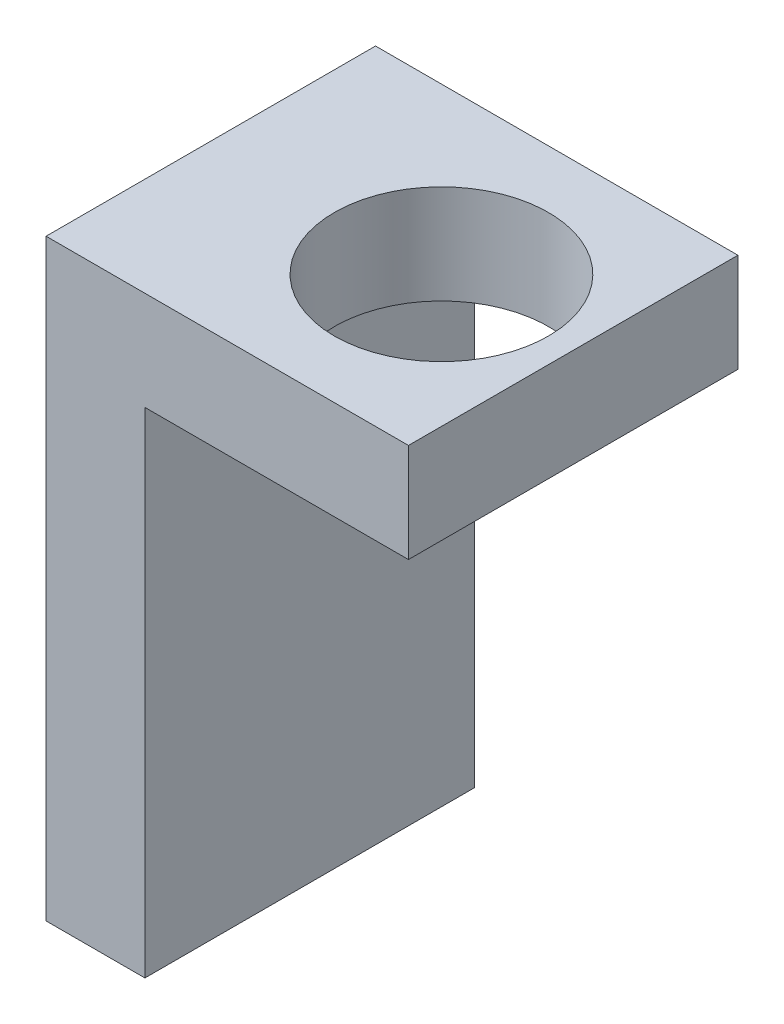
from build123d import *

# Parameters (mm, degrees)
SKETCH1_W           = 8
SKETCH1_H           = 10
SKETCH1_R           = 1.5
BOSS_EXTRUDE1_DEPTH = 3
SKETCH2_W           = 3
SKETCH2_H           = 10
BOSS_EXTRUDE2_DEPTH = 18
SKETCH3_R           = 3.25
CUT_EXTRUDE1_DEPTH  = 3.2


with BuildPart() as part:
    # Sketch1 → Boss-Extrude1 (new body)
    with BuildSketch(Plane(origin=(0, 0, 0), x_dir=(1, 0, 0), z_dir=(0, 1, 0))):
        with Locations((1.5, 0)):
            Rectangle(SKETCH1_W, SKETCH1_H)
        with Locations(Location((1.5, 0, 0), (0, 0, 270))):
            Circle(SKETCH1_R, mode=Mode.SUBTRACT)
    extrude(amount=-BOSS_EXTRUDE1_DEPTH)

    # Sketch2 → Boss-Extrude2 (add)
    with BuildSketch(Plane(origin=(0, 0, 0), x_dir=(1, 0, 0), z_dir=(0, 1, 0))):
        with Locations((-4, 0)):
            Rectangle(SKETCH2_W, SKETCH2_H)
    extrude(amount=-BOSS_EXTRUDE2_DEPTH)

    # Sketch3 → Cut-Extrude1 (cut)
    with BuildSketch(Plane(origin=(0, 0, 0), x_dir=(1, 0, 0), z_dir=(0, 1, 0))):
        with Locations(Location((1.5, 0, 0), (0, 0, 270))):
            Circle(SKETCH3_R)
    extrude(amount=-CUT_EXTRUDE1_DEPTH, mode=Mode.SUBTRACT)


solid = part.part
